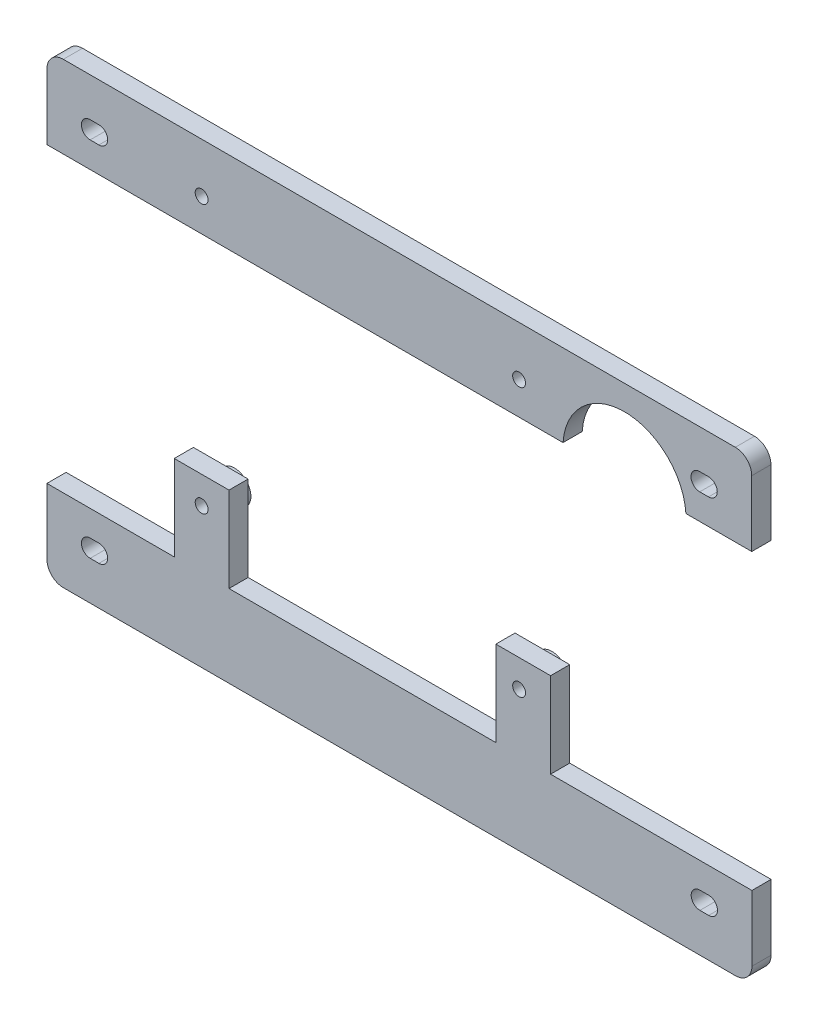
from build123d import *

# Parameters (mm, degrees)
SZKIC1_W                    = 128.8
SZKIC1_H                    = 15
DODANIE_WYCI_GNI_CIE1_DEPTH = 3.5
SZKIC2_W                    = 128.765393654
SZKIC2_H                    = 15
DODANIE_WYCI_GNI_CIE2_DEPTH = 3.5
SZKIC3_R                    = 1.6
WYTNIJ_WYCI_GNI_CIE1_DEPTH  = 95.287994009
SZKIC4_R                    = 11.25
WYTNIJ_WYCI_GNI_CIE2_DEPTH  = 10
SZKIC5_R                    = 3
DODANIE_WYCI_GNI_CIE3_DEPTH = 6
ZAOKR_GLENIE1_R             = 3
ZAOKR_GLENIE2_R             = 3
ZAOKR_GLENIE3_R             = 3
ZAOKR_GLENIE4_R             = 3
SZKIC7_W                    = 10
SZKIC7_H                    = 21.706763169
SZKIC7_H_2                  = 19.767533865
DODANIE_WYCI_GNI_CIE4_DEPTH = 3.5
SZKIC8_R                    = 1.175
WYTNIJ_WYCI_GNI_CIE4_DEPTH  = 95.413853932
WYTNIJ_WYCI_GNI_CIE5_DEPTH  = 95.287994009


with BuildPart() as part:
    # Szkic1 → Dodanie-wyciągnięcie1 (new body)
    with BuildSketch(Plane.XY):
        with Locations((-17.786479808, -30.020087336)):
            Rectangle(SZKIC1_W, SZKIC1_H)
    extrude(amount=DODANIE_WYCI_GNI_CIE1_DEPTH)


with BuildPart() as body_2:
    # Szkic2 → Dodanie-wyciągnięcie2 (new body)
    with BuildSketch(Plane.XY.offset(3.5)):
        with Locations((-17.803782981, 38.579912664)):
            Rectangle(SZKIC2_W, SZKIC2_H)
    extrude(amount=-DODANIE_WYCI_GNI_CIE2_DEPTH)


with BuildPart() as wytnij_wyci_gni_cie1_tool:
    # Szkic3 → Wytnij-wyciągnięcie1 (new, through all)
    with BuildSketch(Plane(origin=(0, 0, 0), x_dir=(-1, 0, 0), z_dir=(0, 0, -1))):
        with Locations((-37.113520192, -28.820087336)):
            Circle(SZKIC3_R)
        with Locations((-37.078913846, 37.379912664)):
            Circle(SZKIC3_R)
        with Locations((72.686479808, -28.820087336)):
            Circle(SZKIC3_R)
        with Locations((72.686479808, 37.379912664)):
            Circle(SZKIC3_R)
    extrude(amount=-WYTNIJ_WYCI_GNI_CIE1_DEPTH)


with BuildPart() as part_1:
    add(part.part)

    # Wytnij-wyciągnięcie1: cut by wytnij_wyci_gni_cie1_tool
    add(wytnij_wyci_gni_cie1_tool.part, mode=Mode.SUBTRACT)

    # Zaokrąglenie1
    zaokr_glenie1_edges = [part_1.edges().sort_by_distance(p)[0] for p in [
        (-82.186479808, -37.520087336, 1.75),
    ]]
    fillet(zaokr_glenie1_edges, radius=ZAOKR_GLENIE1_R)

    # Zaokrąglenie4
    zaokr_glenie4_edges = [part_1.edges().sort_by_distance(p)[0] for p in [
        (46.613520192, -37.520087336, 1.75),
    ]]
    fillet(zaokr_glenie4_edges, radius=ZAOKR_GLENIE4_R)



with BuildPart() as body_2_1:
    add(body_2.part)

    # Wytnij-wyciągnięcie1: cut by wytnij_wyci_gni_cie1_tool
    add(wytnij_wyci_gni_cie1_tool.part, mode=Mode.SUBTRACT)

    # Szkic4 → Wytnij-wyciągnięcie2 (cut)
    with BuildSketch(Plane.XY.offset(3.5)):
        with Locations((23.328913846, 30.329912664)):
            Circle(SZKIC4_R)
    extrude(amount=-WYTNIJ_WYCI_GNI_CIE2_DEPTH, mode=Mode.SUBTRACT)

    # Szkic5 → Dodanie-wyciągnięcie3 (add)
    with BuildSketch(Plane.XY.offset(3.5)):
        with Locations((4.079383089, 37.056776562)):
            Circle(SZKIC5_R)
        with Locations((-53.920616911, 37.035372315)):
            Circle(SZKIC5_R)
        with Locations((-53.920332778, -11.949643617)):
            Circle(SZKIC5_R)
        with Locations((4.079381236, -11.961248969)):
            Circle(SZKIC5_R)
    extrude(amount=-DODANIE_WYCI_GNI_CIE3_DEPTH)


with BuildPart() as dodanie_wyci_gni_cie3_piece_1:
    # of the separate pieces the step leaves, piece 1, a body of its own (dodanie_wyci_gni_cie3_pieces)
    add(body_2_1.part.solids().sort_by_distance((-82.186479808, 31.079912664, 3.5))[0])

    # Zaokrąglenie2
    zaokr_glenie2_edges = [dodanie_wyci_gni_cie3_piece_1.edges().sort_by_distance(p)[0] for p in [
        (-82.186479808, 46.079912664, 1.75),
    ]]
    fillet(zaokr_glenie2_edges, radius=ZAOKR_GLENIE2_R)

    # Zaokrąglenie3
    zaokr_glenie3_edges = [dodanie_wyci_gni_cie3_piece_1.edges().sort_by_distance(p)[0] for p in [
        (46.578913846, 46.079912664, 1.75),
    ]]
    fillet(zaokr_glenie3_edges, radius=ZAOKR_GLENIE3_R)


with BuildPart() as dodanie_wyci_gni_cie3_piece_2:
    # of the separate pieces the step leaves, piece 2, a body of its own (dodanie_wyci_gni_cie3_pieces)
    add(body_2_1.part.solids().sort_by_distance((-50.920332778, -11.949643617, 3.5))[0])


with BuildPart() as dodanie_wyci_gni_cie3_piece_3:
    # of the separate pieces the step leaves, piece 3, a body of its own (dodanie_wyci_gni_cie3_pieces)
    add(body_2_1.part.solids().sort_by_distance((7.079381236, -11.961248969, 3.5))[0])


with BuildPart() as part_2:
    add(part_1.part)

    add(dodanie_wyci_gni_cie3_piece_2.part)  # Dodanie-wyciągnięcie4 merges Dodanie-wyciągnięcie3 piece 2

    add(dodanie_wyci_gni_cie3_piece_3.part)  # Dodanie-wyciągnięcie4 merges Dodanie-wyciągnięcie3 piece 3
    # Szkic7 → Dodanie-wyciągnięcie4 (add)
    with BuildSketch(Plane.XY.offset(3.5)):
        with Locations((4.830175177, -17.788773793)):
            Rectangle(SZKIC7_W, SZKIC7_H)
        with Locations((-53.922751923, -16.82630805)):
            Rectangle(SZKIC7_W, SZKIC7_H_2)
    extrude(amount=-DODANIE_WYCI_GNI_CIE4_DEPTH)


with BuildPart() as wytnij_wyci_gni_cie4_tool:
    # Szkic8 → Wytnij-wyciągnięcie4 (new, through all)
    with BuildSketch(Plane(origin=(0, 0, -2.5), x_dir=(-1, 0, 0), z_dir=(0, 0, -1))):
        with Locations((-4.079381236, -11.961248969)):
            Circle(SZKIC8_R)
        with Locations((53.920332778, -11.949643617)):
            Circle(SZKIC8_R)
        with Locations((53.920616911, 37.035372315)):
            Circle(SZKIC8_R)
        with Locations((-4.079383089, 37.056776562)):
            Circle(SZKIC8_R)
    extrude(amount=-WYTNIJ_WYCI_GNI_CIE4_DEPTH)


with BuildPart() as part_3:
    add(part_2.part)

    # Wytnij-wyciągnięcie4: cut by wytnij_wyci_gni_cie4_tool
    add(wytnij_wyci_gni_cie4_tool.part, mode=Mode.SUBTRACT)


with BuildPart() as dodanie_wyci_gni_cie3_piece_1_1:
    add(dodanie_wyci_gni_cie3_piece_1.part)

    # Wytnij-wyciągnięcie4: cut by wytnij_wyci_gni_cie4_tool
    add(wytnij_wyci_gni_cie4_tool.part, mode=Mode.SUBTRACT)


with BuildPart() as wytnij_wyci_gni_cie5_tool:
    # Szkic9 → Wytnij-wyciągnięcie5 (new, through all)
    with BuildSketch(Plane(origin=(0, 0, 0), x_dir=(-1, 0, 0), z_dir=(0, 0, -1))):
        with BuildLine():
            Line((74.286479808, 35.779912664), (72.686479808, 35.779912664))
            Line((72.686479808, 35.779912664), (72.686479808, 38.979912664))
            Line((72.686479808, 38.979912664), (74.286479808, 38.979912664))
            ThreePointArc((74.286479808, 38.979912664), (75.886479808, 37.379912664), (74.286479808, 35.779912664))
        make_face()
        with BuildLine():
            Line((-38.678913846, 35.779912664), (-37.078913846, 35.779912664))
            Line((-37.078913846, 35.779912664), (-37.078913846, 38.979912664))
            Line((-37.078913846, 38.979912664), (-38.678913846, 38.979912664))
            ThreePointArc((-38.678913846, 38.979912664), (-40.278913846, 37.379912664), (-38.678913846, 35.779912664))
        make_face()
        with BuildLine():
            Line((-38.713520192, -30.420087336), (-37.113520192, -30.420087336))
            Line((-37.113520192, -30.420087336), (-37.113520192, -27.220087336))
            Line((-37.113520192, -27.220087336), (-38.713520192, -27.220087336))
            ThreePointArc((-38.713520192, -27.220087336), (-40.313520192, -28.820087336), (-38.713520192, -30.420087336))
        make_face()
        with BuildLine():
            Line((74.286479808, -30.420087336), (72.686479808, -30.420087336))
            Line((72.686479808, -30.420087336), (72.686479808, -27.220087336))
            Line((72.686479808, -27.220087336), (74.286479808, -27.220087336))
            ThreePointArc((74.286479808, -27.220087336), (75.886479808, -28.820087336), (74.286479808, -30.420087336))
        make_face()
    extrude(amount=-WYTNIJ_WYCI_GNI_CIE5_DEPTH)


with BuildPart() as part_4:
    add(part_3.part)

    # Wytnij-wyciągnięcie5: cut by wytnij_wyci_gni_cie5_tool
    add(wytnij_wyci_gni_cie5_tool.part, mode=Mode.SUBTRACT)


with BuildPart() as dodanie_wyci_gni_cie3_piece_1_2:
    add(dodanie_wyci_gni_cie3_piece_1_1.part)

    # Wytnij-wyciągnięcie5: cut by wytnij_wyci_gni_cie5_tool
    add(wytnij_wyci_gni_cie5_tool.part, mode=Mode.SUBTRACT)


solid = Compound([part_4.part, dodanie_wyci_gni_cie3_piece_1_2.part])
